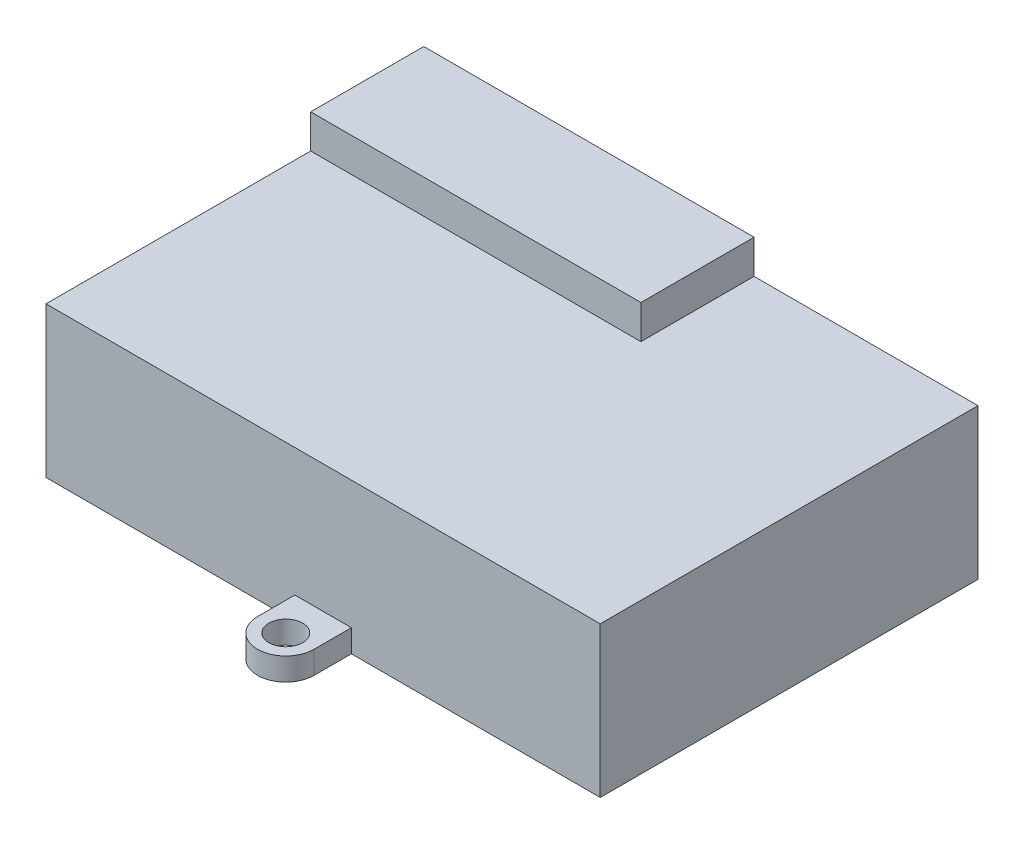
from build123d import *

# Parameters (mm, degrees)
BOSS_EXTRUDE1_DEPTH = 13.3
SKETCH1_3_R         = 1.5
BOSS_EXTRUDE2_DEPTH = 2
SKETCH2_W           = 29.2
SKETCH2_H           = 10
BOSS_EXTRUDE3_DEPTH = 16.3


with BuildPart() as part:
    # Sketch1 → Boss-Extrude1 (new body)
    with BuildSketch(Plane(origin=(0, 0, 0), x_dir=(1, 0, 0), z_dir=(0, 1, 0))):
        Polygon((-2.5, 16.7), (-24.5, 16.7), (-24.5, -16.7), (-2.5, -16.7), (2.5, -16.7), (24.5, -16.7), (24.5, 16.7), (2.5, 16.7), align=None)
    extrude(amount=BOSS_EXTRUDE1_DEPTH)

    # Sketch1<3> → Boss-Extrude2 (add)
    # profile 1 of 2: a face of its own
    with BuildSketch(Plane(origin=(0, 0, 0), x_dir=(1, 0, 0), z_dir=(0, 1, 0))):
        with BuildLine():
            Line((-2.5, 20), (-2.5, 16.7))
            Line((-2.5, 16.7), (2.5, 16.7))
            Line((2.5, 16.7), (2.5, 20))
            ThreePointArc((2.5, 20), (0, 22.5), (-2.5, 20))
        make_face()
        with Locations((0, 20)):
            Circle(SKETCH1_3_R, mode=Mode.SUBTRACT)
    # profile 2 of 2: a face of its own
    with BuildSketch(Plane(origin=(0, 0, 0), x_dir=(1, 0, 0), z_dir=(0, 1, 0))):
        with BuildLine():
            Line((2.5, -16.7), (-2.5, -16.7))
            Line((-2.5, -16.7), (-2.5, -20))
            ThreePointArc((-2.5, -20), (0, -22.5), (2.5, -20))
            Line((2.5, -20), (2.5, -16.7))
        make_face()
        with Locations((0, -20)):
            Circle(SKETCH1_3_R, mode=Mode.SUBTRACT)
    extrude(amount=BOSS_EXTRUDE2_DEPTH)

    # Sketch2 → Boss-Extrude3 (add)
    with BuildSketch(Plane(origin=(0, 0, 0), x_dir=(1, 0, 0), z_dir=(0, 1, 0))):
        with Locations((-9.9, 11.7)):
            Rectangle(SKETCH2_W, SKETCH2_H)
    extrude(amount=BOSS_EXTRUDE3_DEPTH)


solid = part.part
